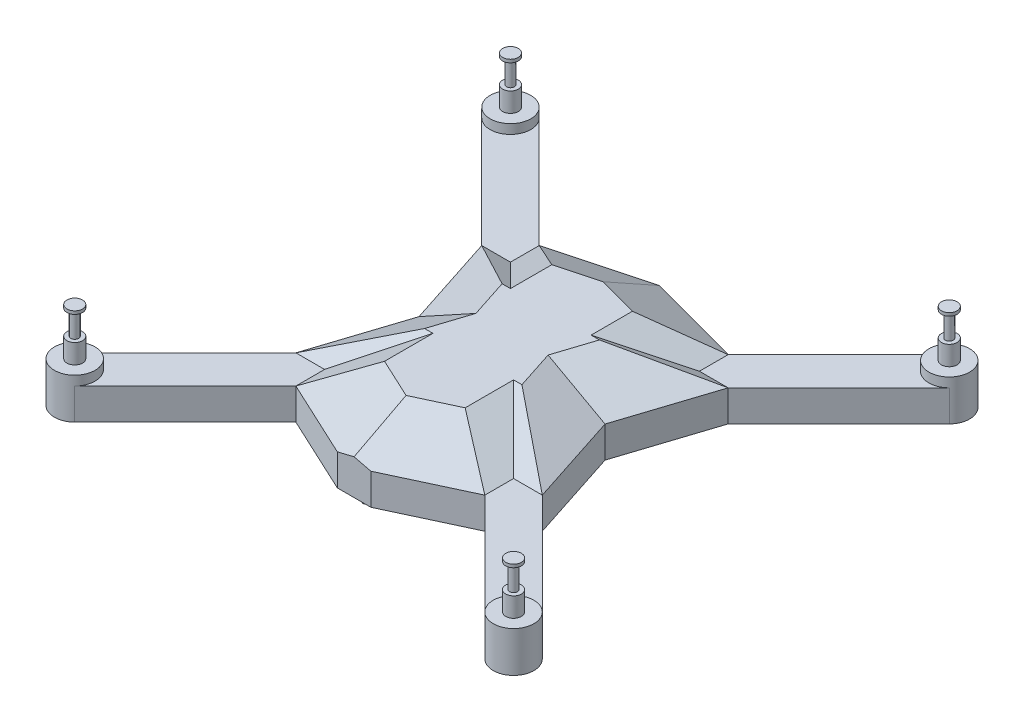
from build123d import *

# Parameters (mm, degrees)
SALIENTE_EXTRUIR1_DEPTH           = 10
SALIENTE_EXTRUIR2_DEPTH           = 13
SALIENTE_EXTRUIR2_TAPER           = 20
SALIENTE_EXTRUIR2_OTHER_WAY_DEPTH = 10
SALIENTE_EXTRUIR2_OTHER_WAY_TAPER = 60
CROQUIS8_W                        = 21.791142798
CROQUIS8_H                        = 20
CORTAR_EXTRUIR3_DEPTH             = 2.5
SALIENTE_EXTRUIR3_DEPTH           = 3
SALIENTE_EXTRUIR3_DEPTH_BACK      = 10
CROQUIS3_R                        = 6.5
CROQUIS4_R                        = 2.5
CORTAR_EXTRUIR1_DEPTH             = 5
CROQUIS6_R                        = 2.5
SALIENTE_EXTRUIR4_DEPTH           = 20
SALIENTE_EXTRUIR4_2_DEPTH         = 20
SALIENTE_EXTRUIR4_3_DEPTH         = 20
SALIENTE_EXTRUIR4_4_DEPTH         = 20
CORTAR_EXTRUIR2_START             = -1
CROQUIS7_R                        = 2.5
CROQUIS7_R_2                      = 1.25
CORTAR_EXTRUIR2_DEPTH             = 7.78
CROQUIS9_W                        = 10.722534602
CROQUIS9_H                        = 19.76388768
CORTAR_EXTRUIR5_DEPTH             = 10


with BuildPart() as part:
    # Croquis1 → Saliente-Extruir1 (new body)
    with BuildSketch(Plane(origin=(0, 0, 0), x_dir=(1, 0, 0), z_dir=(0, 1, 0))):
        Polygon((30.211490956, 91.904855396), (0, 100), (-30.211490956, 91.904855396), (-65.566830015, 127.260194456), (-74.759218171, 118.0678063), (-39.403879111, 82.712467241), (-29.748528135, 52.996352497), (-39.403879111, 23.280237752), (-74.759218171, -12.075101307), (-65.566830015, -21.267489462), (-30.211490956, 14.087849597), (0, 0), (30.211490956, 14.087849597), (65.566830015, -21.267489462), (74.759218171, -12.075101307), (39.403879111, 23.280237752), (29.748528135, 52.996352497), (39.403879111, 82.712467241), (74.759218171, 118.0678063), (65.566830015, 127.260194456), align=None)
    extrude(amount=SALIENTE_EXTRUIR1_DEPTH)

    # Croquis2 → Saliente-Extruir2 (add)
    with BuildSketch(Plane(origin=(0, 10, 0), x_dir=(1, 0, 0), z_dir=(0, 1, 0))):
        Polygon((-39.403879111, 82.712467241), (-29.748528135, 52.996352497), (-39.403879111, 23.280237752), (-30.211490956, 23.280237752), (-30.211490956, 14.087849597), (0, 0), (30.211490956, 14.087849597), (30.211490956, 23.280237752), (39.403879111, 23.280237752), (29.748528135, 52.996352497), (39.403879111, 82.712467241), (30.211490956, 82.712467241), (30.211490956, 91.904855396), (0, 100), (-30.211490956, 91.904855396), (-30.211490956, 82.712467241), align=None)
    extrude(amount=-SALIENTE_EXTRUIR2_DEPTH, taper=SALIENTE_EXTRUIR2_TAPER)

    # Croquis2 → Saliente-Extruir2 other way (add)
    with BuildSketch(Plane(origin=(0, 10, 0), x_dir=(1, 0, 0), z_dir=(0, 1, 0))):
        Polygon((-39.403879111, 82.712467241), (-29.748528135, 52.996352497), (-39.403879111, 23.280237752), (-30.211490956, 23.280237752), (-30.211490956, 14.087849597), (0, 0), (30.211490956, 14.087849597), (30.211490956, 23.280237752), (39.403879111, 23.280237752), (29.748528135, 52.996352497), (39.403879111, 82.712467241), (30.211490956, 82.712467241), (30.211490956, 91.904855396), (0, 100), (-30.211490956, 91.904855396), (-30.211490956, 82.712467241), align=None)
    extrude(amount=SALIENTE_EXTRUIR2_OTHER_WAY_DEPTH, taper=SALIENTE_EXTRUIR2_OTHER_WAY_TAPER)

    # Croquis8 → Cortar-Extruir3 (cut)
    with BuildSketch(Plane.XY):
        Rectangle(CROQUIS8_W, CROQUIS8_H)
    extrude(amount=-CORTAR_EXTRUIR3_DEPTH, mode=Mode.SUBTRACT)

    # Croquis3 → Saliente-Extruir3 (add, two sides: drawn at the far end of the back side and taken through both)
    with BuildSketch(Plane(origin=(0, 10, 0), x_dir=(1, 0, 0), z_dir=(0, 1, 0)).offset(-SALIENTE_EXTRUIR3_DEPTH_BACK)):
        with Locations(Location((70.163024093, -16.671295385, 0), (0, 0, 45))):
            Circle(CROQUIS3_R)
        with Locations(Location((-70.163024093, -16.671295385, 0), (0, 0, 90))):
            Circle(CROQUIS3_R)
        with Locations(Location((70.163024093, 122.664000378, 0), (0, 0, 90))):
            Circle(CROQUIS3_R)
        with Locations(Location((-70.163024093, 122.664000378, 0), (0, 0, 45))):
            Circle(CROQUIS3_R)
    extrude(amount=SALIENTE_EXTRUIR3_DEPTH + SALIENTE_EXTRUIR3_DEPTH_BACK)

    # Croquis4 → Cortar-Extruir1 (cut, symmetric)
    with BuildSketch(Plane(origin=(0, 13, 0), x_dir=(1, 0, 0), z_dir=(0, 1, 0))):
        with Locations(Location((70.163024093, -16.671295385, 0), (0, 0, 270))):
            Circle(CROQUIS4_R)
        with Locations(Location((-70.163024093, -16.671295385, 0), (0, 0, 90))):
            Circle(CROQUIS4_R)
        with Locations(Location((70.163024093, 122.664000378, 0), (0, 0, 90))):
            Circle(CROQUIS4_R)
        with Locations(Location((-70.163024093, 122.664000378, 0), (0, 0, 270))):
            Circle(CROQUIS4_R)
    extrude(amount=CORTAR_EXTRUIR1_DEPTH, both=True, mode=Mode.SUBTRACT)

    # Croquis9 → Cortar-Extruir5 (cut)
    with BuildSketch(Plane.XY.offset(-2.5)):
        with Locations((0, 5.082150096)):
            Rectangle(CROQUIS9_W, CROQUIS9_H)
    extrude(amount=CORTAR_EXTRUIR5_DEPTH, mode=Mode.SUBTRACT)


with BuildPart() as body_2:
    # Croquis6 → Saliente-Extruir4 (new body)
    with BuildSketch(Plane(origin=(0, 8, 0), x_dir=(1, 0, 0), z_dir=(0, 1, 0))):
        with Locations(Location((70.163024093, -16.671295385, 0), (0, 0, 270))):
            Circle(CROQUIS6_R)
    extrude(amount=SALIENTE_EXTRUIR4_DEPTH)


with BuildPart() as body_3:
    # Croquis6 → Saliente-Extruir4 2 (new body)
    with BuildSketch(Plane(origin=(0, 8, 0), x_dir=(1, 0, 0), z_dir=(0, 1, 0))):
        with Locations(Location((70.163024093, 122.664000378, 0), (0, 0, 270))):
            Circle(CROQUIS6_R)
    extrude(amount=SALIENTE_EXTRUIR4_2_DEPTH)


with BuildPart() as body_4:
    # Croquis6 → Saliente-Extruir4 3 (new body)
    with BuildSketch(Plane(origin=(0, 8, 0), x_dir=(1, 0, 0), z_dir=(0, 1, 0))):
        with Locations(Location((-70.163024093, 122.664000378, 0), (0, 0, 270))):
            Circle(CROQUIS6_R)
    extrude(amount=SALIENTE_EXTRUIR4_3_DEPTH)


with BuildPart() as body_5:
    # Croquis6 → Saliente-Extruir4 4 (new body)
    with BuildSketch(Plane(origin=(0, 8, 0), x_dir=(1, 0, 0), z_dir=(0, 1, 0))):
        with Locations(Location((-70.163024093, -16.671295385, 0), (0, 0, 270))):
            Circle(CROQUIS6_R)
    extrude(amount=SALIENTE_EXTRUIR4_4_DEPTH)


with BuildPart() as cortar_extruir2_tool:
    # Croquis7 → Cortar-Extruir2 (new body)
    # profile 1 of 4: a face of its own
    with BuildSketch(Plane(origin=(0, 28, 0), x_dir=(1, 0, 0), z_dir=(0, 1, 0)).offset(CORTAR_EXTRUIR2_START)):
        with Locations(Location((-70.163024093, 122.664000378, 0), (0, 0, 270))):
            Circle(CROQUIS7_R)
        with Locations(Location((-70.163024093, 122.664000378, 0), (0, 0, 90))):
            Circle(CROQUIS7_R_2, mode=Mode.SUBTRACT)
    # profile 2 of 4: a face of its own
    with BuildSketch(Plane(origin=(0, 28, 0), x_dir=(1, 0, 0), z_dir=(0, 1, 0)).offset(CORTAR_EXTRUIR2_START)):
        with Locations(Location((70.163024093, 122.664000378, 0), (0, 0, 270))):
            Circle(CROQUIS7_R)
        with Locations(Location((70.163024093, 122.664000378, 0), (0, 0, 270))):
            Circle(CROQUIS7_R_2, mode=Mode.SUBTRACT)
    # profile 3 of 4: a face of its own
    with BuildSketch(Plane(origin=(0, 28, 0), x_dir=(1, 0, 0), z_dir=(0, 1, 0)).offset(CORTAR_EXTRUIR2_START)):
        with Locations(Location((70.163024093, -16.671295385, 0), (0, 0, 270))):
            Circle(CROQUIS7_R)
        with Locations(Location((70.163024093, -16.671295385, 0), (0, 0, 90))):
            Circle(CROQUIS7_R_2, mode=Mode.SUBTRACT)
    # profile 4 of 4: a face of its own
    with BuildSketch(Plane(origin=(0, 28, 0), x_dir=(1, 0, 0), z_dir=(0, 1, 0)).offset(CORTAR_EXTRUIR2_START)):
        with Locations(Location((-70.163024093, -16.671295385, 0), (0, 0, 270))):
            Circle(CROQUIS7_R)
        with Locations(Location((-70.163024093, -16.671295385, 0), (0, 0, 270))):
            Circle(CROQUIS7_R_2, mode=Mode.SUBTRACT)
    extrude(amount=-CORTAR_EXTRUIR2_DEPTH)


with BuildPart() as body_2_1:
    add(body_2.part)

    # Cortar-Extruir2: cut by cortar_extruir2_tool
    add(cortar_extruir2_tool.part, mode=Mode.SUBTRACT)


with BuildPart() as body_3_1:
    add(body_3.part)

    # Cortar-Extruir2: cut by cortar_extruir2_tool
    add(cortar_extruir2_tool.part, mode=Mode.SUBTRACT)


with BuildPart() as body_4_1:
    add(body_4.part)

    # Cortar-Extruir2: cut by cortar_extruir2_tool
    add(cortar_extruir2_tool.part, mode=Mode.SUBTRACT)


with BuildPart() as body_5_1:
    add(body_5.part)

    # Cortar-Extruir2: cut by cortar_extruir2_tool
    add(cortar_extruir2_tool.part, mode=Mode.SUBTRACT)


solid = Compound([part.part, body_2_1.part, body_3_1.part, body_4_1.part, body_5_1.part])
